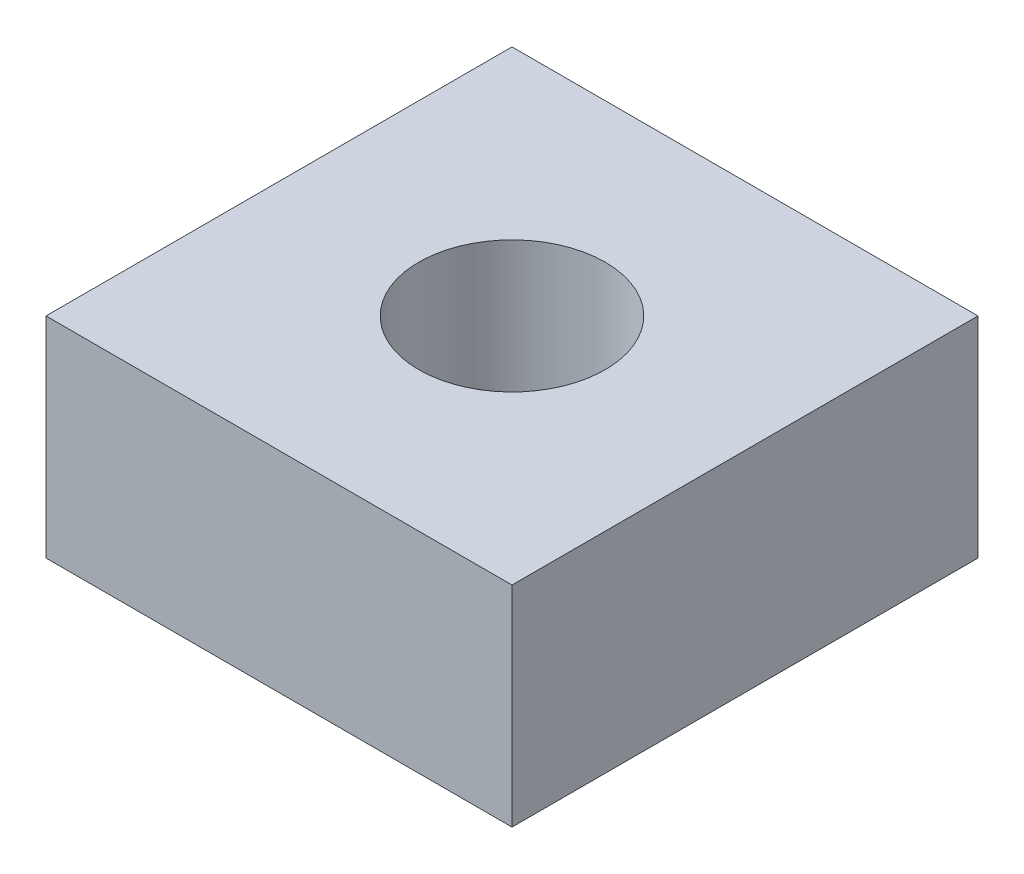
from build123d import *

# Parameters (mm, degrees)
SKETCH1_W           = 10
SKETCH1_H           = 10
SKETCH1_R           = 2
BOSS_EXTRUDE1_DEPTH = 4.5


with BuildPart() as part:
    # Sketch1 → Boss-Extrude1 (new body)
    with BuildSketch(Plane(origin=(0, 0, 0), x_dir=(1, 0, 0), z_dir=(0, 1, 0))):
        Rectangle(SKETCH1_W, SKETCH1_H)
        with Locations(Location((0, 0, 0), (0, 0, 270))):
            Circle(SKETCH1_R, mode=Mode.SUBTRACT)
    extrude(amount=BOSS_EXTRUDE1_DEPTH)


solid = part.part
